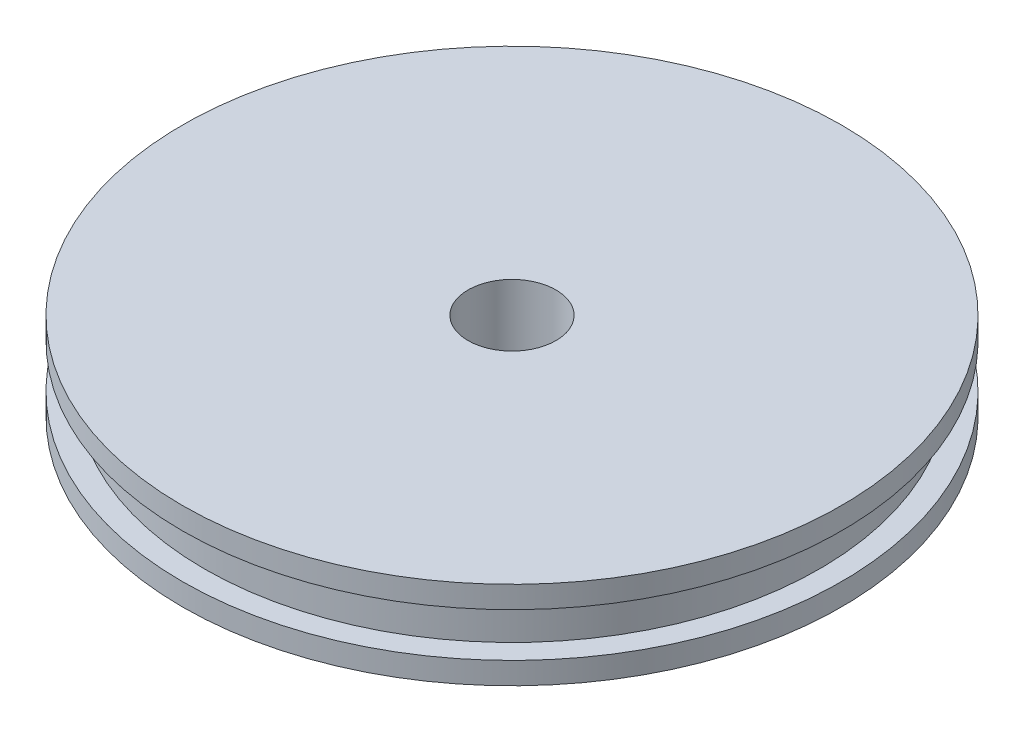
from build123d import *

# Parameters (mm, degrees)
SKETCH1_R           = 35
SKETCH1_R_2         = 7.5
BOSS_EXTRUDE2_DEPTH = 2.5
BOSS_EXTRUDE3_START = 5
SKETCH1_10_R        = 37.5
SKETCH1_10_R_2      = 35
SKETCH1_10_R_3      = 7.5
BOSS_EXTRUDE3_DEPTH = 2.5
BOSS_EXTRUDE4_START = -2.5
SKETCH1_11_R        = 37.5
SKETCH1_11_R_2      = 35
BOSS_EXTRUDE4_DEPTH = 2.5
BOSS_EXTRUDE6_START = -5
SKETCH1_15_R        = 35
SKETCH1_15_R_2      = 7.5
BOSS_EXTRUDE6_DEPTH = 2.5
SKETCH1_16_R        = 7.5
SKETCH1_16_R_2      = 5
BOSS_EXTRUDE7_DEPTH = 5


with BuildPart() as part:
    # Sketch1 → Boss-Extrude2 (new, symmetric)
    with BuildSketch(Plane(origin=(0, 0, 0), x_dir=(1, 0, 0), z_dir=(0, 1, 0))):
        with Locations(Location((0, 0, 0), (0, 0, 270))):
            Circle(SKETCH1_R)
        with Locations(Location((0, 0, 0), (0, 0, 270))):
            Circle(SKETCH1_R_2, mode=Mode.SUBTRACT)
    extrude(amount=BOSS_EXTRUDE2_DEPTH, both=True)

    # Sketch1<10> → Boss-Extrude3 (add)
    # profile 1 of 2: a face of its own
    with BuildSketch(Plane(origin=(0, 0, 0), x_dir=(1, 0, 0), z_dir=(0, 1, 0)).offset(BOSS_EXTRUDE3_START)):
        with Locations(Location((0, 0, 0), (0, 0, 270))):
            Circle(SKETCH1_10_R)
        with Locations(Location((0, 0, 0), (0, 0, 270))):
            Circle(SKETCH1_10_R_2, mode=Mode.SUBTRACT)
    # profile 2 of 2: a face of its own
    with BuildSketch(Plane(origin=(0, 0, 0), x_dir=(1, 0, 0), z_dir=(0, 1, 0)).offset(BOSS_EXTRUDE3_START)):
        with Locations(Location((0, 0, 0), (0, 0, 270))):
            Circle(SKETCH1_10_R_2)
        with Locations(Location((0, 0, 0), (0, 0, 270))):
            Circle(SKETCH1_10_R_3, mode=Mode.SUBTRACT)
    extrude(amount=-BOSS_EXTRUDE3_DEPTH)



with BuildPart() as body_2:
    # Sketch1<11> → Boss-Extrude4 (new body)
    with BuildSketch(Plane(origin=(0, 0, 0), x_dir=(1, 0, 0), z_dir=(0, 1, 0)).offset(BOSS_EXTRUDE4_START)):
        with Locations(Location((0, 0, 0), (0, 0, 270))):
            Circle(SKETCH1_11_R)
        with Locations(Location((0, 0, 0), (0, 0, 270))):
            Circle(SKETCH1_11_R_2, mode=Mode.SUBTRACT)
    extrude(amount=-BOSS_EXTRUDE4_DEPTH)


with BuildPart() as part_1:
    add(part.part)

    add(body_2.part)  # Boss-Extrude6 merges body 2
    # Sketch1<15> → Boss-Extrude6 (add)
    with BuildSketch(Plane(origin=(0, 0, 0), x_dir=(1, 0, 0), z_dir=(0, 1, 0)).offset(BOSS_EXTRUDE6_START)):
        with Locations(Location((0, 0, 0), (0, 0, 270))):
            Circle(SKETCH1_15_R)
        with Locations(Location((0, 0, 0), (0, 0, 270))):
            Circle(SKETCH1_15_R_2, mode=Mode.SUBTRACT)
    extrude(amount=BOSS_EXTRUDE6_DEPTH)

    # Sketch1<16> → Boss-Extrude7 (add, symmetric)
    with BuildSketch(Plane(origin=(0, 0, 0), x_dir=(1, 0, 0), z_dir=(0, 1, 0))):
        Circle(SKETCH1_16_R)
        with Locations(Location((0, 0, 0), (0, 0, 270))):
            Circle(SKETCH1_16_R_2, mode=Mode.SUBTRACT)
    extrude(amount=BOSS_EXTRUDE7_DEPTH, both=True)


solid = part_1.part
